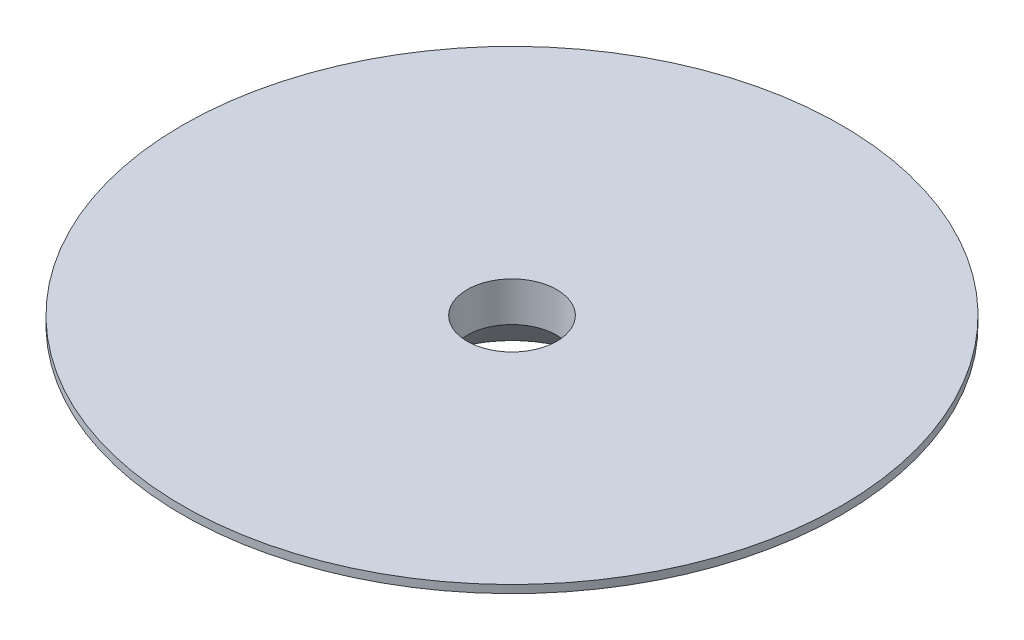
from build123d import *

# Parameters (mm, degrees)
CONG_1_R = 10


with BuildPart() as part:
    # Esquisse1 → Révolution1 (revolve)
    with BuildSketch(Plane.XY, mode=Mode.PRIVATE) as r_volution1_sk:
        Polygon((0, -3.3), (8.21555598, -3.3), (12.5, -0.3), (12.5, 0), (0, 0), align=None)
    revolve(r_volution1_sk.sketch.rotate(Axis((0, 0, 0), (0, -1, 0)), 180), axis=Axis((0, 0, 0), (0, -1, 0)))

    # Congé1
    cong_1_edges = [part.edges().sort_by_distance(p)[0] for p in [
        (8.21555598, -3.3, 0),
    ]]
    fillet(cong_1_edges, radius=CONG_1_R)

    # Esquisse2 → Fraisage pour vis à tête fraisée M31 (revolve, cut)
    with BuildSketch(Plane(origin=(0, -3.3, 0), x_dir=(0, 0, -1), z_dir=(1, 0, 0))):
        Polygon((0, 0), (0, 3.3), (1.7, 3.3), (1.7, 1.8), (3.5, 0), align=None)
    revolve(axis=Axis((0, -9.65, 0), (0, 1, 0)), mode=Mode.SUBTRACT)


solid = part.part
